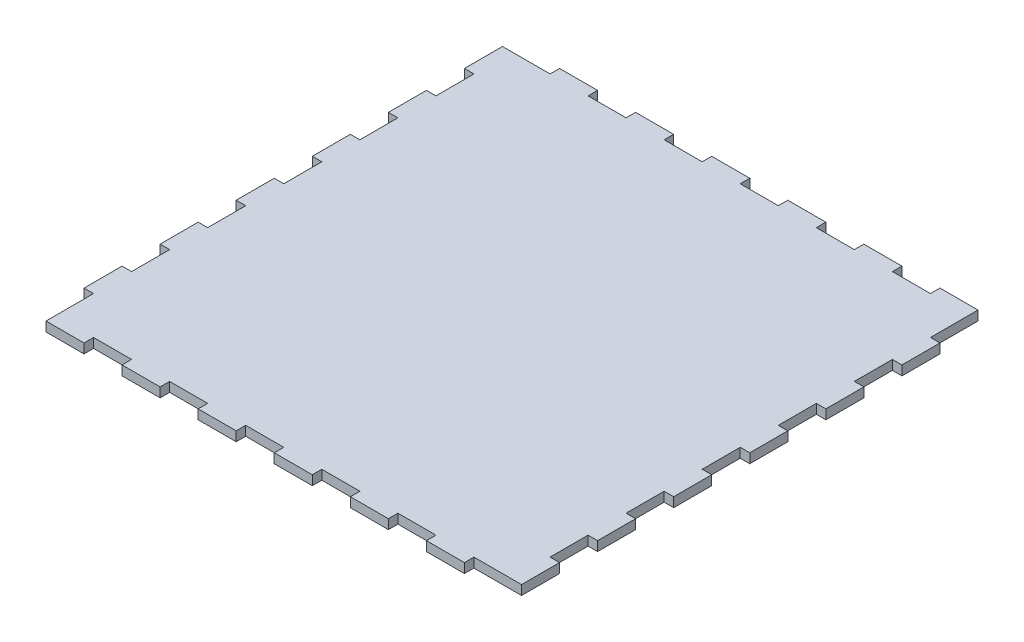
from build123d import *

# Parameters (mm, degrees)
BOSS_EXTRUDE1_DEPTH = 6.35


with BuildPart() as part:
    # Sketch1 → Boss-Extrude1 (new body)
    with BuildSketch(Plane(origin=(0, 0, 0), x_dir=(1, 0, 0), z_dir=(0, 1, 0))):
        Polygon((-65.292450766, -101.6), (-39.892450766, -101.6), (-39.892450766, -107.95), (-14.492450766, -107.95), (-14.492450766, -101.6), (10.907549234, -101.6), (10.907549234, -107.95), (36.307549234, -107.95), (36.307549234, -101.6), (61.707549234, -101.6), (61.707549234, -107.95), (87.107549234, -107.95), (87.107549234, -101.6), (112.507549234, -101.6), (112.507549234, -107.95), (137.907549234, -107.95), (137.907549234, -101.6), (163.307549234, -101.6), (163.307549234, -107.95), (188.707549234, -107.95), (188.707549234, -101.6), (220.457549234, -101.6), (220.457549234, -76.2), (214.107549234, -76.2), (214.107549234, -50.8), (220.457549234, -50.8), (220.457549234, -25.4), (214.107549234, -25.4), (214.107549234, 0), (220.457549234, 0), (220.457549234, 25.4), (214.107549234, 25.4), (214.107549234, 50.8), (220.457549234, 50.8), (220.457549234, 76.2), (214.107549234, 76.2), (214.107549234, 101.6), (220.457549234, 101.6), (220.457549234, 127), (214.107549234, 127), (214.107549234, 152.4), (220.457549234, 152.4), (220.457549234, 177.8), (214.107549234, 177.8), (214.107549234, 209.55), (188.707549234, 209.55), (188.707549234, 203.2), (163.307549234, 203.2), (163.307549234, 209.55), (137.907549234, 209.55), (137.907549234, 203.2), (112.507549234, 203.2), (112.507549234, 209.55), (87.107549234, 209.55), (87.107549234, 203.2), (61.707549234, 203.2), (61.707549234, 209.55), (36.307549234, 209.55), (36.307549234, 203.2), (10.907549234, 203.2), (10.907549234, 209.55), (-14.492450766, 209.55), (-14.492450766, 203.2), (-39.892450766, 203.2), (-39.892450766, 209.55), (-65.292450766, 209.55), (-65.292450766, 203.2), (-97.042450766, 203.2), (-97.042450766, 177.8), (-90.692450766, 177.8), (-90.692450766, 152.4), (-97.042450766, 152.4), (-97.042450766, 127), (-90.692450766, 127), (-90.692450766, 101.6), (-97.042450766, 101.6), (-97.042450766, 76.2), (-90.692450766, 76.2), (-90.692450766, 50.8), (-97.042450766, 50.8), (-97.042450766, 25.4), (-90.692450766, 25.4), (-90.692450766, 0), (-97.042450766, 0), (-97.042450766, -25.4), (-90.692450766, -25.4), (-90.692450766, -50.8), (-97.042450766, -50.8), (-97.042450766, -76.2), (-90.692450766, -76.2), (-90.692450766, -107.95), (-65.292450766, -107.95), align=None)
    extrude(amount=BOSS_EXTRUDE1_DEPTH)


solid = part.part
